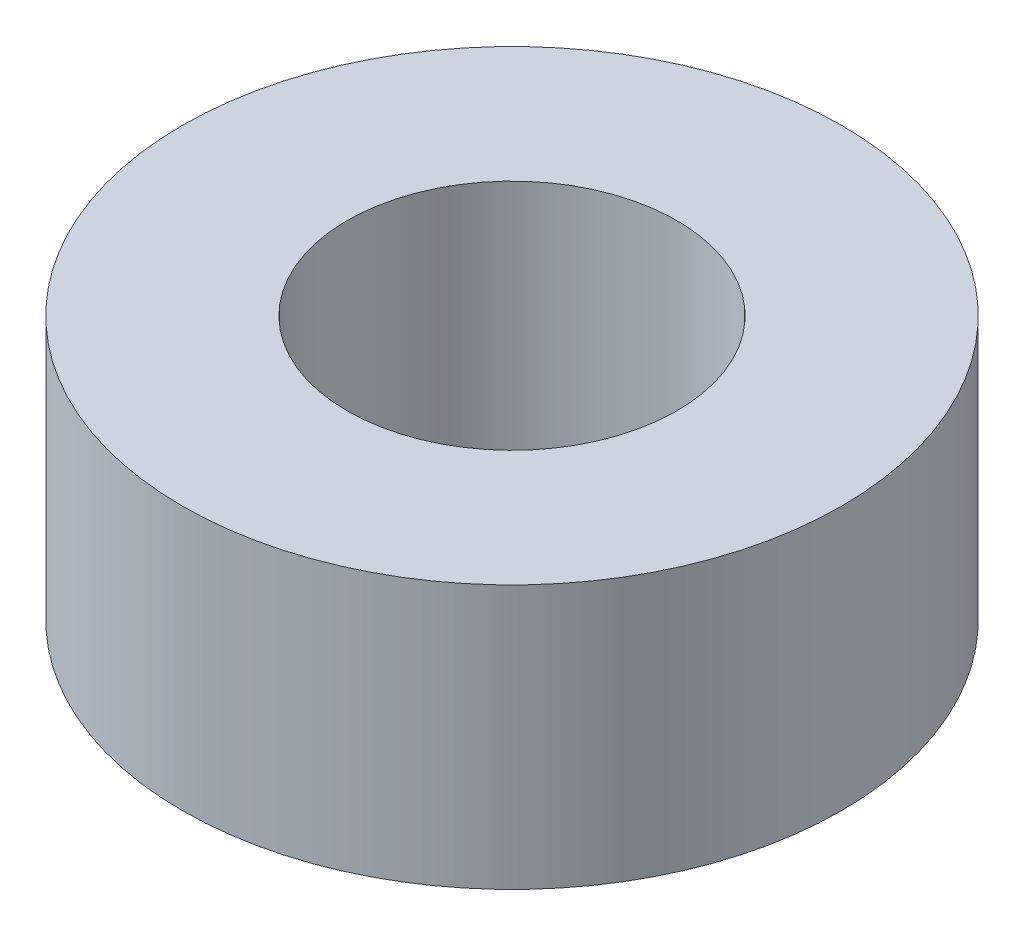
from build123d import *

# Parameters (mm, degrees)
SKETCH_1_R      = 5
SKETCH_1_R_2    = 2.5
EXTRUDE_1_DEPTH = 4


with BuildPart() as part:
    # 草图1 → 凸台-拉伸1 (new body)
    with BuildSketch(Plane(origin=(0, 0, 0), x_dir=(1, 0, 0), z_dir=(0, 1, 0))):
        with Locations(Location((0, 0, 0), (0, 0, 270))):
            Circle(SKETCH_1_R)
        with Locations(Location((0, 0, 0), (0, 0, 270))):
            Circle(SKETCH_1_R_2, mode=Mode.SUBTRACT)
    extrude(amount=EXTRUDE_1_DEPTH)


solid = part.part
